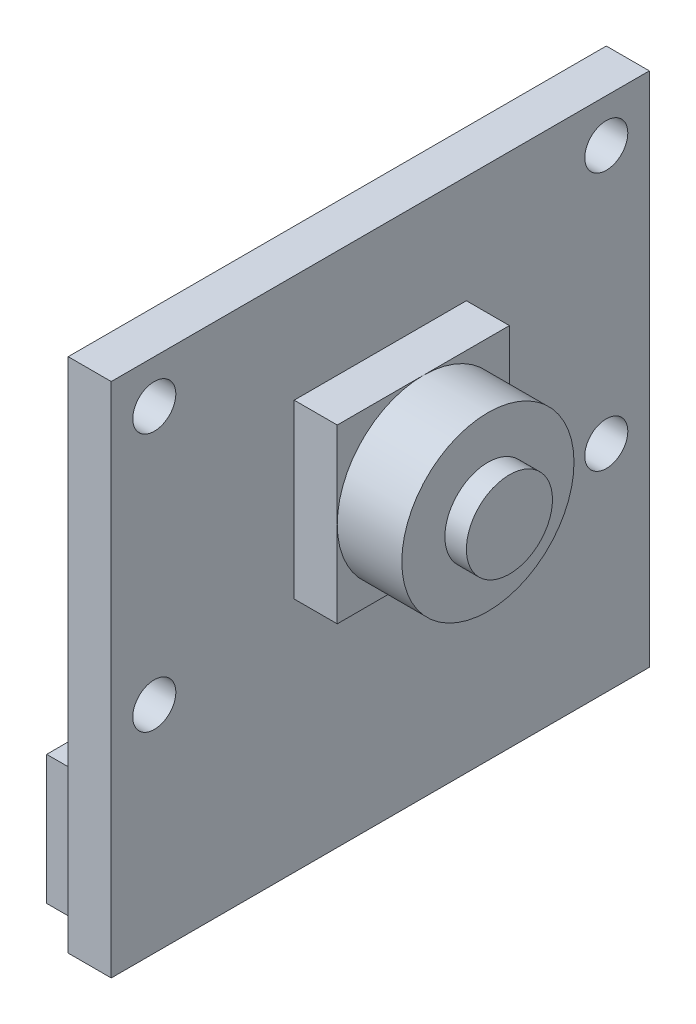
from build123d import *

# Parameters (mm, degrees)
SKETCH1_W           = 25
SKETCH1_H           = 24
SKETCH1_R           = 1
BOSS_EXTRUDE1_DEPTH = 2
SKETCH2_W           = 8
SKETCH2_H           = 8
BOSS_EXTRUDE2_DEPTH = 2
SKETCH3_R           = 4
BOSS_EXTRUDE3_DEPTH = 3
SKETCH4_R           = 2
BOSS_EXTRUDE4_DEPTH = 1
SKETCH5_W           = 21
SKETCH5_H           = 6
BOSS_EXTRUDE5_DEPTH = 3


with BuildPart() as part:
    # Sketch1 → Boss-Extrude1 (new body)
    with BuildSketch(Plane(origin=(0, 0, 0), x_dir=(0, 0, -1), z_dir=(1, 0, 0))):
        Rectangle(SKETCH1_W, SKETCH1_H)
        with Locations((10.5, 10)):
            Circle(SKETCH1_R, mode=Mode.SUBTRACT)
        with Locations((10.5, -2)):
            Circle(SKETCH1_R, mode=Mode.SUBTRACT)
        with Locations(Location((-10.5, 10, 0), (0, 0, 180))):
            Circle(SKETCH1_R, mode=Mode.SUBTRACT)
        with Locations(Location((-10.5, -2, 0), (0, 0, 180))):
            Circle(SKETCH1_R, mode=Mode.SUBTRACT)
    extrude(amount=BOSS_EXTRUDE1_DEPTH)

    # Sketch2 → Boss-Extrude2 (add)
    with BuildSketch(Plane(origin=(2, 0, 0), x_dir=(0, 0, -1), z_dir=(1, 0, 0))):
        with Locations((0, 3)):
            Rectangle(SKETCH2_W, SKETCH2_H)
    extrude(amount=BOSS_EXTRUDE2_DEPTH)

    # Sketch3 → Boss-Extrude3 (add)
    with BuildSketch(Plane(origin=(4, 0, 0), x_dir=(0, 0, -1), z_dir=(1, 0, 0))):
        with Locations((0, 3)):
            Circle(SKETCH3_R)
    extrude(amount=BOSS_EXTRUDE3_DEPTH)

    # Sketch4 → Boss-Extrude4 (add)
    with BuildSketch(Plane(origin=(7, 0, 0), x_dir=(0, 0, -1), z_dir=(1, 0, 0))):
        with Locations((0, 3)):
            Circle(SKETCH4_R)
    extrude(amount=BOSS_EXTRUDE4_DEPTH)

    # Sketch5 → Boss-Extrude5 (add)
    with BuildSketch(Plane.ZY):
        with Locations((0, -9.5)):
            Rectangle(SKETCH5_W, SKETCH5_H)
    extrude(amount=BOSS_EXTRUDE5_DEPTH)


solid = part.part
